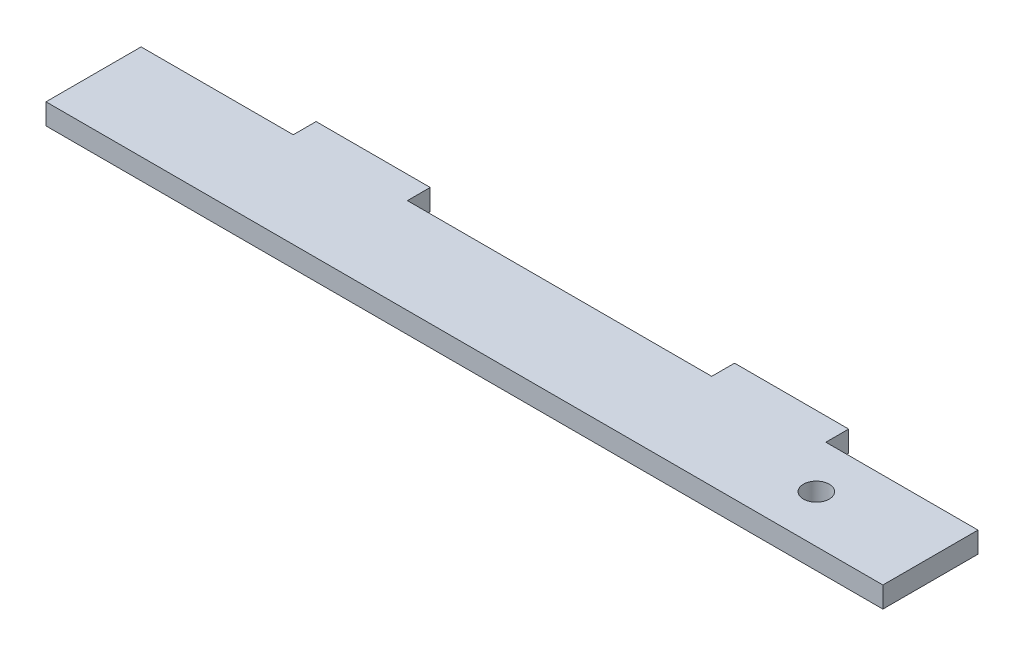
from build123d import *

# Parameters (mm, degrees)
SKETCH1_W           = 30
SKETCH1_H           = 6
SKETCH1_W_2         = 220
SKETCH1_H_2         = 25
BOSS_EXTRUDE1_DEPTH = 5.5
SKETCH3_R           = 3.4
CUT_EXTRUDE1_DEPTH  = 112.680347421


with BuildPart() as part:
    # Sketch1 → Boss-Extrude1 (new body)
    with BuildSketch(Plane(origin=(0, 0, 0), x_dir=(1, 0, 0), z_dir=(0, 1, 0))):
        with Locations((-55, 15.5)):
            Rectangle(SKETCH1_W, SKETCH1_H)
        Rectangle(SKETCH1_W_2, SKETCH1_H_2)
        with Locations((55, 15.5)):
            Rectangle(SKETCH1_W, SKETCH1_H)
    extrude(amount=BOSS_EXTRUDE1_DEPTH)

    # Sketch3 → Cut-Extrude1 (cut, through all)
    with BuildSketch(Plane(origin=(0, 5.5, 0), x_dir=(1, 0, 0), z_dir=(0, 1, 0))):
        with Locations(Location((80, 0, 0), (0, 0, 270))):
            Circle(SKETCH3_R)
    extrude(amount=-CUT_EXTRUDE1_DEPTH, mode=Mode.SUBTRACT)


solid = part.part
